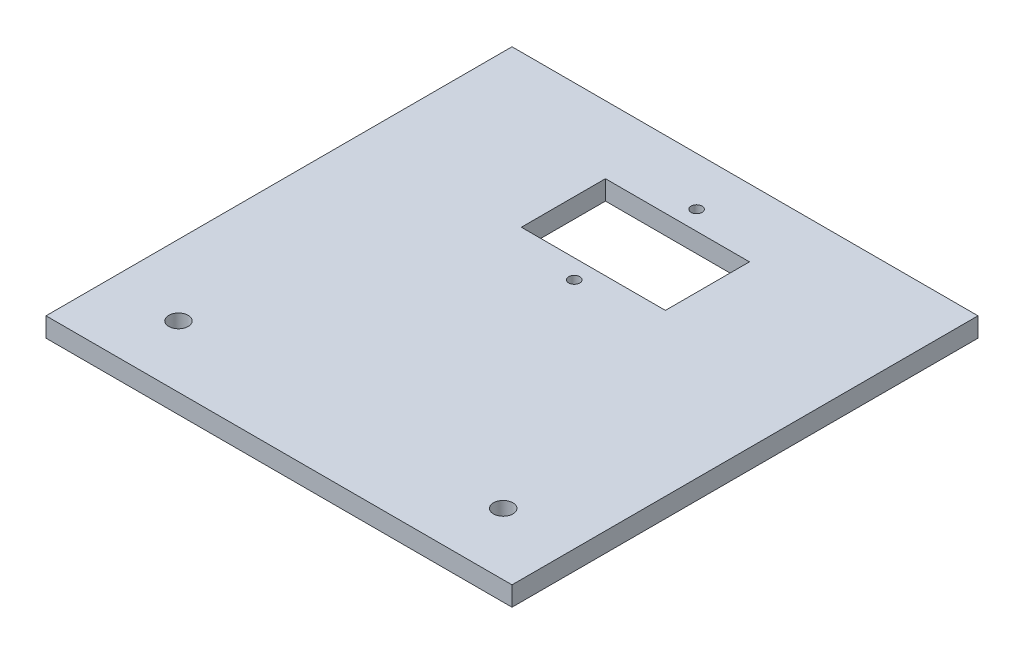
from build123d import *

# Parameters (mm, degrees)
SKETCH3_W           = 152.4
SKETCH3_H           = 152.4
BOSS_EXTRUDE1_DEPTH = 3.175
SKETCH4_R           = 1.8
SKETCH4_W           = 47.1
SKETCH4_H           = 27.5
CUT_EXTRUDE1_DEPTH  = 10
SKETCH5_R           = 3.175
CUT_EXTRUDE2_DEPTH  = 5


with BuildPart() as part:
    # Sketch3 → Boss-Extrude1 (new, symmetric)
    with BuildSketch(Plane(origin=(0, 0, 0), x_dir=(1, 0, 0), z_dir=(0, 1, 0))):
        Rectangle(SKETCH3_W, SKETCH3_H)
    extrude(amount=BOSS_EXTRUDE1_DEPTH, both=True)

    # Sketch4 → Cut-Extrude1 (cut)
    with BuildSketch(Plane(origin=(0, 3.175, 0), x_dir=(1, 0, 0), z_dir=(0, 1, 0))):
        with Locations(Location((0, 60.361146992, 0), (0, 0, 270))):
            Circle(SKETCH4_R)
        with Locations(Location((0, 20.361146992, 0), (0, 0, 90))):
            Circle(SKETCH4_R)
        with Locations((0, 40.361146992)):
            Rectangle(SKETCH4_W, SKETCH4_H)
    extrude(amount=-CUT_EXTRUDE1_DEPTH, mode=Mode.SUBTRACT)

    # Sketch5 → Cut-Extrude2 (cut, symmetric)
    with BuildSketch(Plane(origin=(0, 0, 0), x_dir=(1, 0, 0), z_dir=(0, 1, 0))):
        with Locations(Location((-53.096867931, -55.98098713, 0), (0, 0, 90))):
            Circle(SKETCH5_R)
        with Locations(Location((53.096867931, -55.98098713, 0), (0, 0, 90))):
            Circle(SKETCH5_R)
    extrude(amount=CUT_EXTRUDE2_DEPTH, both=True, mode=Mode.SUBTRACT)


solid = part.part
